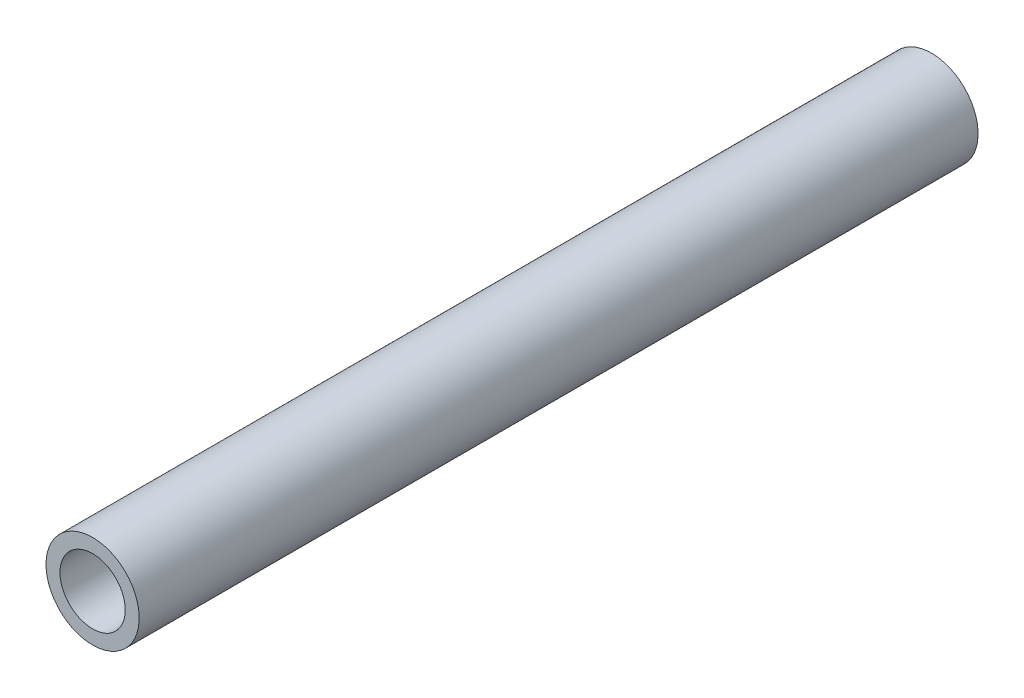
from build123d import *

# Parameters (mm, degrees)
SKETCH1_R           = 5
SKETCH1_R_2         = 3.5
BOSS_EXTRUDE1_DEPTH = 90


with BuildPart() as part:
    # Sketch1 → Boss-Extrude1 (new body)
    with BuildSketch(Plane.XY):
        with Locations(Location((0, 0, 0), (0, 0, 180))):
            Circle(SKETCH1_R)
        with Locations(Location((0, 0, 0), (0, 0, 180))):
            Circle(SKETCH1_R_2, mode=Mode.SUBTRACT)
    extrude(amount=BOSS_EXTRUDE1_DEPTH)


solid = part.part
